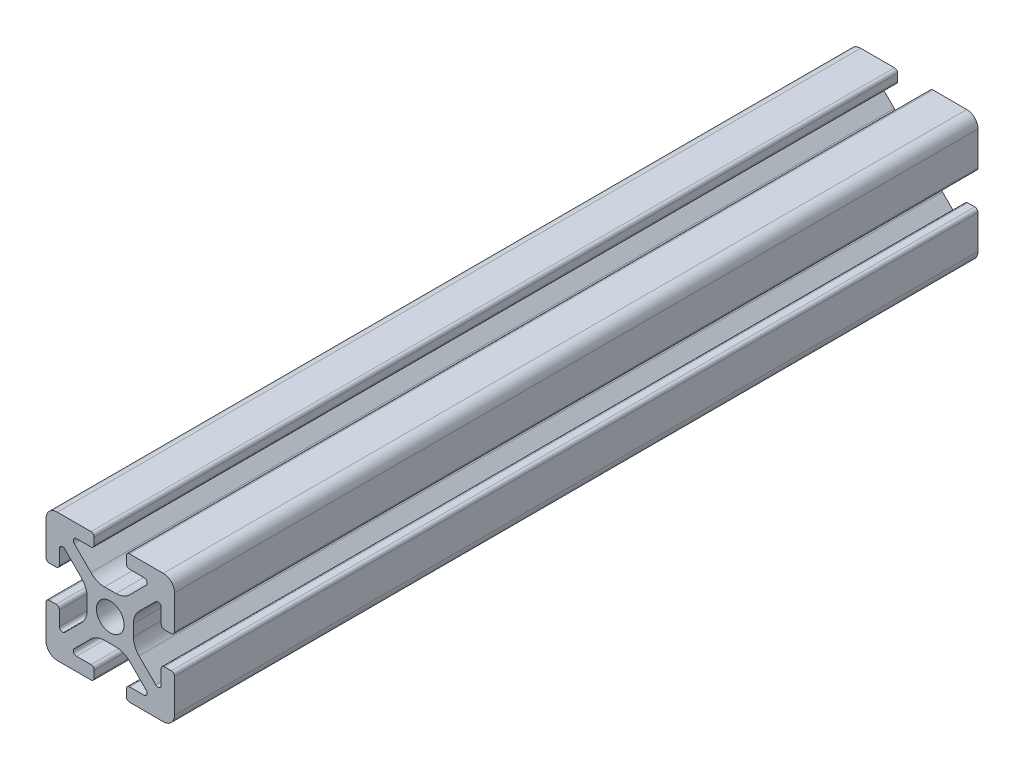
from build123d import *

# Parameters (mm, degrees)
BOSS_EXTRUDE1_DEPTH = 62.5


with BuildPart() as part:
    # Sketch4 → Boss-Extrude1 (new, symmetric)
    with BuildSketch(Plane.XY):
        with BuildLine():
            Line((3, -10), (8.25, -10))
            ThreePointArc((8.25, -10), (9.487436867, -9.487436867), (10, -8.25))
            Line((10, -8.25), (10, -3))
            ThreePointArc((10, -3), (9.853553391, -2.646446609), (9.5, -2.5))
            Line((9.5, -2.5), (8.424621202, -2.5))
            ThreePointArc((8.424621202, -2.5), (8.071067812, -2.646446609), (7.924621202, -3))
            Line((7.924621202, -3), (7.924621202, -5.25))
            ThreePointArc((7.924621202, -5.25), (7.615962919, -5.711939766), (7.071067812, -5.603553391))
            Line((7.071067812, -5.603553391), (4.478679656, -3.011165235))
            ThreePointArc((4.478679656, -3.011165235), (3.828361402, -2.037895189), (3.6, -0.889844892))
            Line((3.6, -0.889844892), (3.6, 0))
            Line((3.6, 0), (2.15, 0))
            ThreePointArc((2.15, 0), (1.52027958, -1.52027958), (0, -2.15))
            Line((0, -2.15), (0, -3.6))
            Line((0, -3.6), (0.889844892, -3.6))
            ThreePointArc((0.889844892, -3.6), (2.037895189, -3.828361402), (3.011165235, -4.478679656))
            Line((3.011165235, -4.478679656), (5.603553391, -7.071067812))
            ThreePointArc((5.603553391, -7.071067812), (5.711939766, -7.615962919), (5.25, -7.924621202))
            Line((5.25, -7.924621202), (3, -7.924621202))
            ThreePointArc((3, -7.924621202), (2.646446609, -8.071067812), (2.5, -8.424621202))
            Line((2.5, -8.424621202), (2.5, -9.5))
            ThreePointArc((2.5, -9.5), (2.646446609, -9.853553391), (3, -10))
        make_face()
    extrude(amount=BOSS_EXTRUDE1_DEPTH, both=True)

    # Mirror1: part across plane


with BuildPart() as part_1:
    add(part.part)
    add(part.part.mirror(Plane(origin=(0, 0, 0), x_dir=(0, 0, 1), z_dir=(1, 0, 0))))

    # Mirror2: part across plane


with BuildPart() as part_2:
    add(part_1.part)
    add(part_1.part.mirror(Plane.ZX))


solid = part_2.part
